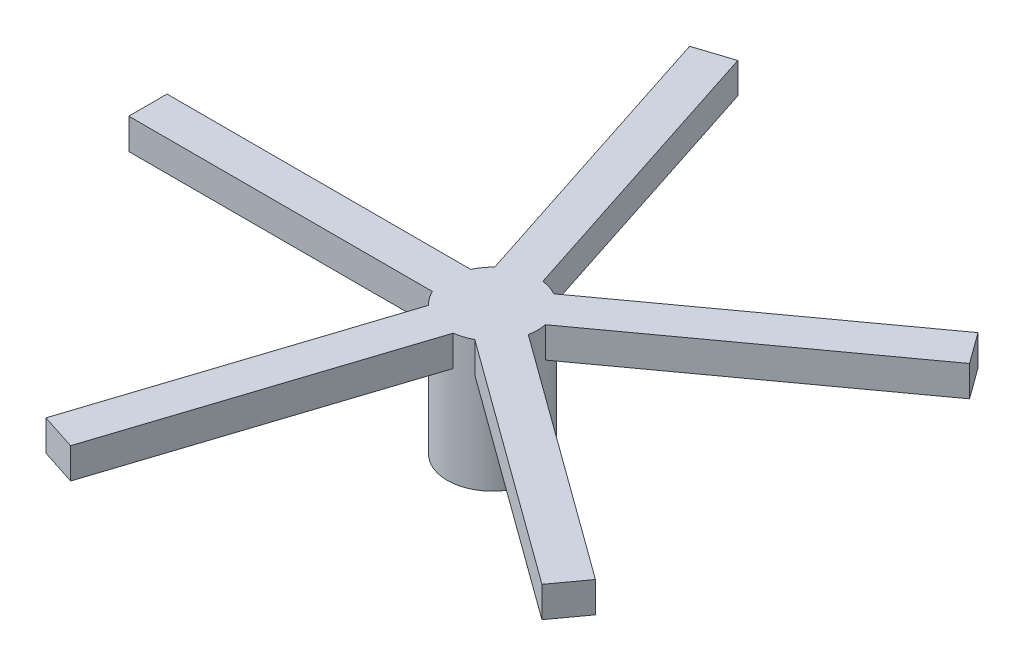
from build123d import *

# Parameters (mm, degrees)
SKETCH1_R           = 7.493
SKETCH1_R_2         = 4.318
BOSS_EXTRUDE1_DEPTH = 21.59
SKETCH2_W           = 57.15
SKETCH2_H           = 5.08
BOSS_EXTRUDE2_DEPTH = 3.175
CIRPATTERN1_COUNT   = 5


with BuildPart() as part:
    # Sketch1 → Boss-Extrude1 (new body)
    with BuildSketch(Plane(origin=(0, 0, 0), x_dir=(1, 0, 0), z_dir=(0, 1, 0))):
        with Locations(Location((0, 0, 0), (0, 0, 270))):
            Circle(SKETCH1_R)
        with Locations(Location((0, 0, 0), (0, 0, 270))):
            Circle(SKETCH1_R_2, mode=Mode.SUBTRACT)
    extrude(amount=BOSS_EXTRUDE1_DEPTH)

    # Sketch2 → Boss-Extrude2 (add, symmetric)
    with BuildSketch(Plane.XY):
        with Locations((-28.575, 19.05)):
            Rectangle(SKETCH2_W, SKETCH2_H)
    boss_extrude2 = extrude(amount=BOSS_EXTRUDE2_DEPTH, both=True)

    # CirPattern1: Boss-Extrude2 ×5 about axis
    cirpattern1_axis = Axis((0, 0, 0), (0, 1, 0))
    for i in range(1, CIRPATTERN1_COUNT):
        add(boss_extrude2.rotate(cirpattern1_axis, i * 360 / CIRPATTERN1_COUNT))


solid = part.part
